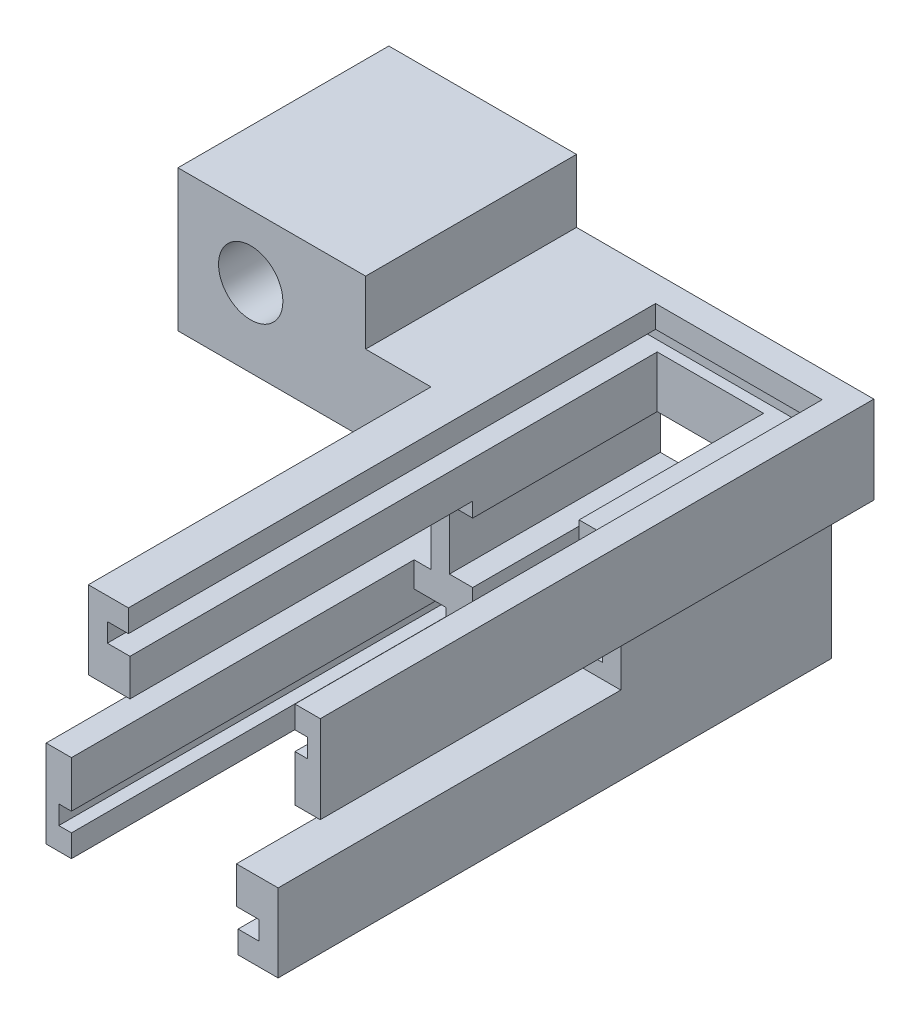
from build123d import *

# Parameters (mm, degrees)
SKETCH2_W            = 26
SKETCH2_H            = 23.3
BOSS_EXTRUDE1_DEPTH  = 20
SKETCH3_W            = 14.5
SKETCH3_H            = 5.7
CUT_EXTRUDE1_DEPTH   = 20
SKETCH4_W            = 10.09
SKETCH4_H            = 4.9
CUT_EXTRUDE2_DEPTH   = 17.5
SKETCH5_W            = 10.09
SKETCH5_H            = 4.9
CUT_EXTRUDE3_DEPTH   = 17.5
SKETCH10_W           = 3
SKETCH10_H           = 2
CUT_EXTRUDE4_DEPTH   = 17.5
SKETCH11_W           = 3
SKETCH11_H           = 2
CUT_EXTRUDE5_DEPTH   = 17.5
SKETCH7_W            = 19
SKETCH7_H            = 1.78
CUT_EXTRUDE6_DEPTH   = 18.5
SKETCH6_W            = 19
SKETCH6_H            = 1.78
CUT_EXTRUDE7_DEPTH   = 18.5
SKETCH9_W            = 15.8
SKETCH9_H            = 2.12
CUT_EXTRUDE8_DEPTH   = 17.5
SKETCH12_W           = 15.8
SKETCH12_H           = 2.12
CUT_EXTRUDE9_DEPTH   = 17.5
SKETCH14_W           = 7.8
SKETCH14_H           = 20
BOSS_EXTRUDE2_DEPTH  = 6
SKETCH13_W           = 20
SKETCH13_H           = 12
BOSS_EXTRUDE3_DEPTH  = 20
SKETCH15_R           = 3.05
CUT_EXTRUDE10_DEPTH  = 19
SKETCH16_W           = 4
SKETCH16_H           = 15
CUT_EXTRUDE11_DEPTH  = 20
SKETCH18_W           = 4
SKETCH18_H           = 9
CUT_EXTRUDE12_DEPTH  = 20
BOSS_EXTRUDE8_DEPTH  = 32.5
BOSS_EXTRUDE9_DEPTH  = 32.5
SKETCH23_W           = 10
SKETCH23_H           = 20
CUT_EXTRUDE14_DEPTH  = 6
SKETCH24_W           = 24
SKETCH24_H           = 20
BOSS_EXTRUDE10_DEPTH = 1.4
SKETCH26_R           = 1.45
CUT_EXTRUDE15_DEPTH  = 10


with BuildPart() as part:
    # Sketch2 → Boss-Extrude1 (new body)
    with BuildSketch(Plane.XY):
        Rectangle(SKETCH2_W, SKETCH2_H)
    extrude(amount=BOSS_EXTRUDE1_DEPTH)

    # Sketch3 → Cut-Extrude1 (cut)
    with BuildSketch(Plane.XY.offset(20)):
        Rectangle(SKETCH3_W, SKETCH3_H)
    extrude(amount=-CUT_EXTRUDE1_DEPTH, mode=Mode.SUBTRACT)

    # Sketch4 → Cut-Extrude2 (cut)
    with BuildSketch(Plane.XY.offset(20)):
        with Locations((0, 5.3)):
            Rectangle(SKETCH4_W, SKETCH4_H)
    extrude(amount=-CUT_EXTRUDE2_DEPTH, mode=Mode.SUBTRACT)

    # Sketch5 → Cut-Extrude3 (cut)
    with BuildSketch(Plane.XY.offset(20)):
        with Locations((0, -5.3)):
            Rectangle(SKETCH5_W, SKETCH5_H)
    extrude(amount=-CUT_EXTRUDE3_DEPTH, mode=Mode.SUBTRACT)

    # Sketch10 → Cut-Extrude4 (cut)
    with BuildSketch(Plane.XY.offset(20)):
        with Locations((9.1, 6.75)):
            Rectangle(SKETCH10_W, SKETCH10_H)
    extrude(amount=-CUT_EXTRUDE4_DEPTH, mode=Mode.SUBTRACT)

    # Sketch11 → Cut-Extrude5 (cut)
    with BuildSketch(Plane.XY.offset(20)):
        with Locations((-9.1, -6.75)):
            Rectangle(SKETCH11_W, SKETCH11_H)
    extrude(amount=-CUT_EXTRUDE5_DEPTH, mode=Mode.SUBTRACT)

    # Sketch7 → Cut-Extrude6 (cut)
    with BuildSketch(Plane.XY.offset(20)):
        with Locations((-2.3, -8.64)):
            Rectangle(SKETCH7_W, SKETCH7_H)
    extrude(amount=-CUT_EXTRUDE6_DEPTH, mode=Mode.SUBTRACT)

    # Sketch6 → Cut-Extrude7 (cut)
    with BuildSketch(Plane.XY.offset(20)):
        with Locations((2.3, 8.64)):
            Rectangle(SKETCH6_W, SKETCH6_H)
    extrude(amount=-CUT_EXTRUDE7_DEPTH, mode=Mode.SUBTRACT)

    # Sketch9 → Cut-Extrude8 (cut)
    with BuildSketch(Plane.XY.offset(20)):
        with Locations((2.7, 10.59)):
            Rectangle(SKETCH9_W, SKETCH9_H)
    extrude(amount=-CUT_EXTRUDE8_DEPTH, mode=Mode.SUBTRACT)

    # Sketch12 → Cut-Extrude9 (cut)
    with BuildSketch(Plane.XY.offset(20)):
        with Locations((-2.7, -10.59)):
            Rectangle(SKETCH12_W, SKETCH12_H)
    extrude(amount=-CUT_EXTRUDE9_DEPTH, mode=Mode.SUBTRACT)

    # Sketch14 → Boss-Extrude2 (add)
    with BuildSketch(Plane(origin=(0, 11.65, 0), x_dir=(1, 0, 0), z_dir=(0, 1, 0))):
        with Locations((-9.1, -10)):
            Rectangle(SKETCH14_W, SKETCH14_H)
    extrude(amount=BOSS_EXTRUDE2_DEPTH)

    # Sketch13 → Boss-Extrude3 (add)
    with BuildSketch(Plane.ZY.offset(13)):
        with Locations((10, 11.65)):
            Rectangle(SKETCH13_W, SKETCH13_H)
    extrude(amount=BOSS_EXTRUDE3_DEPTH)

    # Sketch15 → Cut-Extrude10 (cut)
    with BuildSketch(Plane.XY.offset(20)):
        with Locations((-26.1, 11.65)):
            Circle(SKETCH15_R)
    extrude(amount=-CUT_EXTRUDE10_DEPTH, mode=Mode.SUBTRACT)

    # Sketch16 → Cut-Extrude11 (cut)
    with BuildSketch(Plane.XY.offset(20)):
        with Locations((11, -4.15)):
            Rectangle(SKETCH16_W, SKETCH16_H)
    extrude(amount=-CUT_EXTRUDE11_DEPTH, mode=Mode.SUBTRACT)

    # Sketch18 → Cut-Extrude12 (cut)
    with BuildSketch(Plane.XY.offset(20)):
        with Locations((-11, 1.15)):
            Rectangle(SKETCH18_W, SKETCH18_H)
    extrude(amount=-CUT_EXTRUDE12_DEPTH, mode=Mode.SUBTRACT)

    # Sketch21 → Boss-Extrude8 (add)
    with BuildSketch(Plane.XY.offset(20)):
        Polygon((-13, -11.65), (-13, -3.35), (-10.6, -3.35), (-10.6, -7.75), (-11.8, -7.75), (-11.8, -9.53), (-10.6, -9.53), (-10.6, -11.65), align=None)
        Polygon((5.2, -9.53), (5.2, -11.65), (9, -11.65), (9, -4.25), (5.045, -4.25), (5.045, -7.75), (7.2, -7.75), (7.2, -9.53), align=None)
    extrude(amount=BOSS_EXTRUDE8_DEPTH)

    # Sketch22 → Boss-Extrude9 (add)
    with BuildSketch(Plane.XY.offset(20)):
        Polygon((10.6, 11.65), (13, 11.65), (13, 3.35), (10.6, 3.35), (10.6, 7.75), (11.8, 7.75), (11.8, 9.53), (10.6, 9.53), align=None)
        Polygon((-5.2, 9.53), (-5.2, 11.65), (-9, 11.65), (-9, 4.25), (-5.045, 4.25), (-5.045, 7.75), (-7.2, 7.75), (-7.2, 9.53), align=None)
    extrude(amount=BOSS_EXTRUDE9_DEPTH)

    # Sketch23 → Cut-Extrude14 (cut)
    with BuildSketch(Plane(origin=(0, 17.65, 0), x_dir=(1, 0, 0), z_dir=(0, 1, 0))):
        with Locations((-10.2, -10)):
            Rectangle(SKETCH23_W, SKETCH23_H)
    extrude(amount=-CUT_EXTRUDE14_DEPTH, mode=Mode.SUBTRACT)

    # Sketch24 → Boss-Extrude10 (add)
    with BuildSketch(Plane.XZ.offset(-5.65)):
        with Locations((-21, 10)):
            Rectangle(SKETCH24_W, SKETCH24_H)
    extrude(amount=BOSS_EXTRUDE10_DEPTH)

    # Sketch26 → Cut-Extrude15 (cut)
    with BuildSketch(Plane(origin=(0, 0, 0), x_dir=(-1, 0, 0), z_dir=(0, 0, -1))):
        with Locations((26.1, 11.65)):
            Circle(SKETCH26_R)
    extrude(amount=-CUT_EXTRUDE15_DEPTH, mode=Mode.SUBTRACT)


solid = part.part
